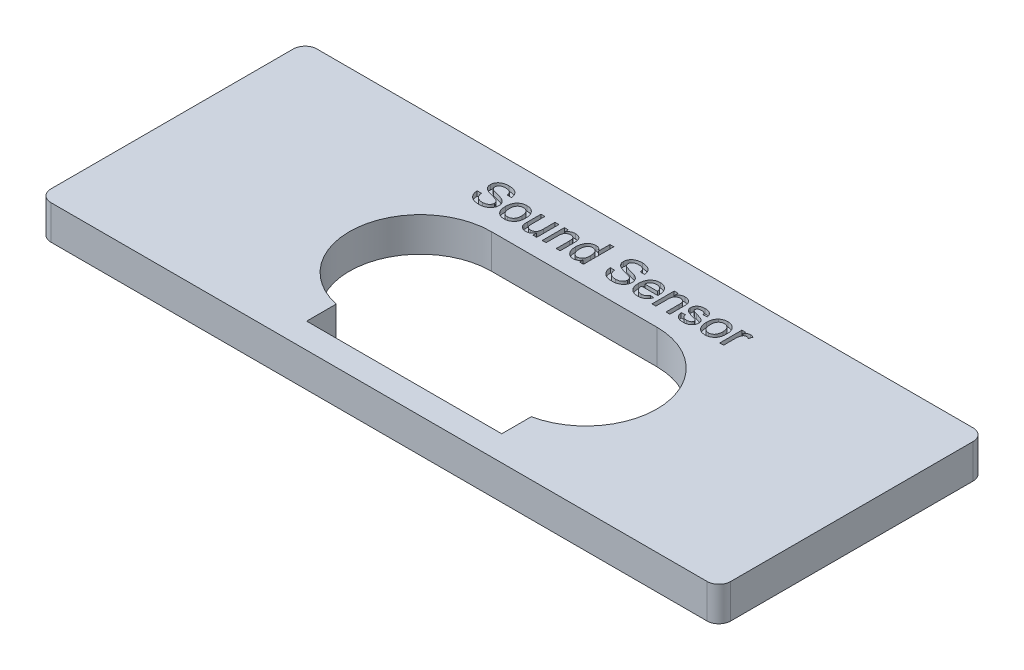
from build123d import *

# Parameters (mm, degrees)
BOSS_EXTRUDE1_DEPTH = 2.9
CUT_EXTRUDE1_DEPTH  = 10
CUT_EXTRUDE2_DEPTH  = 0.5
CUT_EXTRUDE3_DEPTH  = 10


with BuildPart() as part:
    # Sketch1 → Boss-Extrude1 (new body)
    with BuildSketch(Plane(origin=(0, 0, 0), x_dir=(1, 0, 0), z_dir=(0, 1, 0))):
        with BuildLine():
            Line((1, 0), (56.5, 0))
            ThreePointArc((56.5, 0), (57.207106781, 0.292893219), (57.5, 1))
            Line((57.5, 1), (57.5, 21.5))
            ThreePointArc((57.5, 21.5), (57.207106781, 22.207106781), (56.5, 22.5))
            Line((56.5, 22.5), (1, 22.5))
            ThreePointArc((1, 22.5), (0.292893219, 22.207106781), (0, 21.5))
            Line((0, 21.5), (0, 1))
            ThreePointArc((0, 1), (0.292893219, 0.292893219), (1, 0))
        make_face()
    extrude(amount=BOSS_EXTRUDE1_DEPTH)

    # Sketch2 → Cut-Extrude1 (cut)
    with BuildSketch(Plane(origin=(0, 3, 0), x_dir=(1, 0, 0), z_dir=(0, 1, 0))):
        with BuildLine():
            Line((21.75, 16.5), (35.75, 16.5))
            ThreePointArc((35.75, 16.5), (41.75, 10.5), (35.75, 4.5))
            Line((35.75, 4.5), (21.75, 4.5))
            ThreePointArc((21.75, 4.5), (15.75, 10.5), (21.75, 16.5))
        make_face()
    extrude(amount=-CUT_EXTRUDE1_DEPTH, mode=Mode.SUBTRACT)

    # Sketch4 → Cut-Extrude2 (cut)
    # profile 1 of 11: a face of its own
    with BuildSketch(Plane(origin=(0, 3, 0), x_dir=(1, 0, 0), z_dir=(0, 1, 0))):
        with BuildLine():
            Line((18.164635813, 18.889033391), (18.526834602, 18.889033391))
            add(Edge.make_bspline(
                [(18.526834602, 18.889033391), (18.530818579, 18.85651292), (18.538472012, 18.794039345), (18.559871777, 18.705492457), (18.587414654, 18.625879717), (18.62173232, 18.554144523), (18.666875903, 18.491146978), (18.721266154, 18.434324153), (18.787320154, 18.385119028), (18.861880063, 18.341329691), (18.944918993, 18.306948135), (19.033570457, 18.281460522), (19.127411664, 18.266358908), (19.191668348, 18.264411619), (19.22447886, 18.263417301)],
                knots=[0, 0, 0, 0, 1.125557648, 2.162256852, 3.1243583, 4.018160113, 4.88511607, 5.777380551, 6.711250965, 7.707237736, 8.743031335, 9.791730543, 10.872421559, 12, 12, 12, 12], degree=3))
            add(Edge.make_bspline(
                [(19.22447886, 18.263417301), (19.253513338, 18.263954698), (19.310124946, 18.265002519), (19.392019966, 18.27758944), (19.469083417, 18.29544365), (19.539881069, 18.322450937), (19.604151757, 18.355246251), (19.659963648, 18.394912954), (19.707612873, 18.439646097), (19.744925669, 18.490623929), (19.774237857, 18.544040171), (19.795741377, 18.59894656), (19.808550583, 18.655038338), (19.810182809, 18.692779778), (19.810993944, 18.711535405)],
                knots=[0, 0, 0, 0, 1.267006637, 2.470417599, 3.611360613, 4.716023143, 5.771382139, 6.754486395, 7.697536124, 8.612899418, 9.501261124, 10.352596716, 11.181322154, 12, 12, 12, 12], degree=3))
            add(Edge.make_bspline(
                [(19.810993944, 18.711535405), (19.810126826, 18.730101048), (19.808432043, 18.766387571), (19.797387614, 18.819216215), (19.776396116, 18.86756977), (19.749157234, 18.913421801), (19.7112633, 18.95534355), (19.66338859, 18.993970702), (19.604478305, 19.028990452), (19.560510639, 19.048169308), (19.537286905, 19.058299586)],
                knots=[0, 0, 0, 0, 0.942140154, 1.841411588, 2.718743672, 3.605002079, 4.535543111, 5.568170452, 6.715506882, 8, 8, 8, 8], degree=3))
            add(Edge.make_bspline(
                [(19.537286905, 19.058299586), (19.528238595, 19.062012714), (19.507796818, 19.070401345), (19.472760572, 19.081506447), (19.431185629, 19.095866478), (19.382073184, 19.110654973), (19.325686158, 19.126299132), (19.26211843, 19.144005948), (19.19140552, 19.162836178), (19.115552969, 19.182878906), (19.038965006, 19.203259288), (18.965794156, 19.223658755), (18.898473495, 19.244366827), (18.836451576, 19.264305842), (18.780048151, 19.284327118), (18.729103134, 19.303882517), (18.683553009, 19.322575285), (18.655732726, 19.336319791), (18.642594158, 19.342810851)],
                knots=[0, 0, 0, 0, 0.499201778, 1.127787504, 1.87543728, 2.745208432, 3.745951656, 4.863402235, 6.114490242, 7.482339553, 8.869366102, 10.161191451, 11.360587006, 12.46547846, 13.487450326, 14.41601931, 15.251940103, 16, 16, 16, 16], degree=3))
            add(Edge.make_bspline(
                [(18.642594158, 19.342810851), (18.612365978, 19.359140984), (18.554017724, 19.390662392), (18.475487436, 19.447022758), (18.409317696, 19.509565014), (18.355787662, 19.578198474), (18.313838268, 19.65176238), (18.285535196, 19.730381791), (18.266149928, 19.812629618), (18.264338324, 19.869187894), (18.263417301, 19.897942233)],
                knots=[0, 0, 0, 0, 1.158441928, 2.236094408, 3.251151369, 4.220012324, 5.163146324, 6.095083285, 7.031536583, 8, 8, 8, 8], degree=3))
            add(Edge.make_bspline(
                [(18.263417301, 19.897942233), (18.264639682, 19.929782807), (18.267070988, 19.993113477), (18.288638007, 20.086047287), (18.323037815, 20.175474332), (18.362195244, 20.246471774), (18.40038239, 20.300159723), (18.432039824, 20.338824802), (18.467549829, 20.374565469), (18.505818818, 20.407880641), (18.54753089, 20.438272549), (18.591651163, 20.466990263), (18.639776545, 20.491673828), (18.707399864, 20.523090435), (18.797863571, 20.554462854), (18.911746064, 20.581799938), (19.031603647, 20.597898179), (19.113301392, 20.600114174), (19.155023127, 20.601245848)],
                knots=[0, 0, 0, 0, 1.199927478, 2.386647047, 3.578628709, 4.806592355, 5.433127754, 6.062729195, 6.689531802, 7.331674828, 7.974827539, 8.635320743, 9.315455226, 10.01318112, 11.447700238, 12.918145351, 14.426146008, 16, 16, 16, 16], degree=3))
            add(Edge.make_bspline(
                [(19.155023127, 20.601245848), (19.200690336, 20.600199453), (19.289613193, 20.598161922), (19.418820617, 20.581210031), (19.539335772, 20.552099174), (19.633847892, 20.519512491), (19.703719596, 20.486522895), (19.753358401, 20.460781448), (19.799433027, 20.431019647), (19.84235824, 20.398812722), (19.882532757, 20.364175382), (19.918924002, 20.326283719), (19.953112185, 20.286430528), (19.993288063, 20.229213833), (20.036606178, 20.15348786), (20.074060584, 20.055381855), (20.099792198, 19.951839022), (20.104797589, 19.88025721), (20.107338408, 19.843921107)],
                knots=[0, 0, 0, 0, 1.607600973, 3.130308851, 4.577334065, 5.967726088, 6.640410691, 7.296826776, 7.935019992, 8.569057421, 9.185393759, 9.8003086, 10.417295362, 11.032210203, 12.259799365, 13.477607022, 14.719591916, 16, 16, 16, 16], degree=3))
            Line((20.107338408, 19.843921107), (19.745139619, 19.843921107))
            add(Edge.make_bspline(
                [(19.745139619, 19.843921107), (19.742838261, 19.862311871), (19.738335186, 19.898297146), (19.727163655, 19.950391245), (19.711503416, 19.9987739), (19.693160477, 20.043896311), (19.670924995, 20.085289157), (19.645004856, 20.1233499), (19.61508441, 20.157630118), (19.581933539, 20.189035626), (19.54454347, 20.216381057), (19.503106324, 20.240117731), (19.457552154, 20.260169784), (19.407921094, 20.276593071), (19.354203316, 20.289327044), (19.29627664, 20.298694398), (19.234163455, 20.30349184), (19.191387072, 20.30442326), (19.16942876, 20.304901384)],
                knots=[0, 0, 0, 0, 1.074487479, 2.102453544, 3.083708351, 4.020042547, 4.923259678, 5.803182661, 6.684453325, 7.556870173, 8.445961597, 9.363679789, 10.320905216, 11.327237703, 12.390948353, 13.519046902, 14.726457512, 16, 16, 16, 16], degree=3))
            add(Edge.make_bspline(
                [(19.16942876, 20.304901384), (19.146604119, 20.304729343), (19.102421228, 20.304396313), (19.038549849, 20.298325597), (18.979349336, 20.289996359), (18.924921373, 20.277710025), (18.875444259, 20.261627172), (18.830183682, 20.243055168), (18.790406308, 20.219519588), (18.755184858, 20.193304012), (18.724801896, 20.164297927), (18.698616284, 20.133732525), (18.675457132, 20.102505842), (18.65746196, 20.068911005), (18.642811186, 20.034220303), (18.633359826, 19.997781663), (18.626668043, 19.960269106), (18.625971587, 19.934673537), (18.62561609, 19.921608631)],
                knots=[0, 0, 0, 0, 1.464176581, 2.834285765, 4.113735764, 5.29917439, 6.409476712, 7.449999357, 8.431575861, 9.367089851, 10.262376129, 11.120706676, 11.948504824, 12.751342953, 13.560717798, 14.359016663, 15.162382702, 16, 16, 16, 16], degree=3))
            add(Edge.make_bspline(
                [(18.62561609, 19.921608631), (18.626552097, 19.899511946), (18.6283688, 19.856624318), (18.646919995, 19.795693926), (18.675451863, 19.740151926), (18.703560299, 19.709931808), (18.717709248, 19.694719901)],
                knots=[0, 0, 0, 0, 1.050964922, 2.039826012, 3.013306874, 4, 4, 4, 4], degree=3))
            add(Edge.make_bspline(
                [(18.717709248, 19.694719901), (18.726628594, 19.687117719), (18.746353178, 19.67030596), (18.783053806, 19.648057567), (18.828557142, 19.625578401), (18.883167232, 19.60323237), (18.946790116, 19.580748196), (19.019323171, 19.557597974), (19.101042666, 19.534605476), (19.189458201, 19.512448399), (19.278778508, 19.490202249), (19.363662829, 19.468040886), (19.441601004, 19.447038012), (19.512469378, 19.426553149), (19.576341303, 19.406644221), (19.632994799, 19.386894109), (19.682888216, 19.368729016), (19.713453828, 19.355948391), (19.727647064, 19.350013668)],
                knots=[0, 0, 0, 0, 0.523891492, 1.158553688, 1.913783773, 2.794766643, 3.797521443, 4.933638669, 6.202080764, 7.596537849, 9.013317056, 10.322179469, 11.523240428, 12.626146501, 13.623953177, 14.517289671, 15.311498917, 16, 16, 16, 16], degree=3))
            add(Edge.make_bspline(
                [(19.727647064, 19.350013668), (19.746113184, 19.341499601), (19.782359083, 19.324787913), (19.833706252, 19.296255222), (19.881618732, 19.266625558), (19.925709422, 19.23510119), (19.965835754, 19.201615809), (20.002446388, 19.166553082), (20.035762441, 19.130110069), (20.064439611, 19.09112038), (20.090188768, 19.051160155), (20.112720994, 19.009670897), (20.130863511, 18.966408617), (20.146775629, 18.921894801), (20.158221006, 18.875634326), (20.167196491, 18.828094453), (20.17243174, 18.779051733), (20.172936876, 18.745846704), (20.173192733, 18.72902796)],
                knots=[0, 0, 0, 0, 1.198900896, 2.353241543, 3.461831299, 4.520043694, 5.547003373, 6.541368882, 7.508191797, 8.454912692, 9.392021408, 10.310662301, 11.235020644, 12.156274873, 13.095836685, 14.042125239, 15.00831306, 16, 16, 16, 16], degree=3))
            add(Edge.make_bspline(
                [(20.173192733, 18.72902796), (20.171852376, 18.695462319), (20.169191323, 18.628823365), (20.146278689, 18.530594466), (20.110284153, 18.43541121), (20.068071644, 18.359878054), (20.028168064, 18.302181699), (19.994647174, 18.260712197), (19.957474435, 18.222367322), (19.917565001, 18.185945803), (19.874609014, 18.152190759), (19.828244327, 18.121090694), (19.778960298, 18.09232186), (19.708583944, 18.057265351), (19.615112454, 18.020592914), (19.496048541, 17.99005335), (19.370569597, 17.97024158), (19.284408009, 17.968143682), (19.240427955, 17.967072837)],
                knots=[0, 0, 0, 0, 1.197055466, 2.376552968, 3.581957237, 4.820753935, 5.454298064, 6.085440993, 6.72202542, 7.359198513, 8.013298489, 8.67051481, 9.351020706, 10.049282741, 11.476266879, 12.925760103, 14.430794493, 16, 16, 16, 16], degree=3))
            add(Edge.make_bspline(
                [(19.240427955, 17.967072837), (19.212464523, 17.967303604), (19.157688155, 17.967755644), (19.077200401, 17.973229986), (19.000067514, 17.98114889), (18.926365192, 17.992944187), (18.856324556, 18.008418975), (18.789694192, 18.027001205), (18.726316168, 18.048402474), (18.666411929, 18.073569996), (18.61013785, 18.102811906), (18.556482065, 18.134356529), (18.506321615, 18.170113838), (18.459550906, 18.20952196), (18.414984866, 18.251442431), (18.374470626, 18.297587248), (18.336630806, 18.34660697), (18.302330034, 18.398950244), (18.271687515, 18.453932248), (18.244131161, 18.510629617), (18.220914548, 18.569453647), (18.202204166, 18.630107042), (18.186355526, 18.69218391), (18.17536486, 18.756202172), (18.167284152, 18.821960836), (18.165523807, 18.866543814), (18.164635813, 18.889033391)],
                knots=[0, 0, 0, 0, 1.259822038, 2.467811403, 3.633536148, 4.752793854, 5.829021491, 6.863980041, 7.868367876, 8.841470325, 9.788447787, 10.724101269, 11.643985084, 12.560193707, 13.478453146, 14.398077254, 15.323914234, 16.266973849, 17.21495974, 18.158525798, 19.105629373, 20.061269543, 21.017128399, 21.990322895, 22.986232211, 24, 24, 24, 24], degree=3))
        make_face()
    # profile 2 of 11: a face of its own
    with BuildSketch(Plane(origin=(0, 3, 0), x_dir=(1, 0, 0), z_dir=(0, 1, 0))):
        with BuildLine():
            add(Edge.make_bspline(
                [(20.50246436, 18.938424135), (20.503386382, 18.980129887), (20.505170564, 19.060833563), (20.51794689, 19.177940811), (20.539850969, 19.286662486), (20.57059034, 19.3871007), (20.610342439, 19.4792871), (20.659451134, 19.562704462), (20.716562015, 19.638885308), (20.762139753, 19.681946116), (20.784917677, 19.703466179)],
                knots=[0, 0, 0, 0, 1.189940866, 2.302622481, 3.356378305, 4.350088409, 5.294652018, 6.213657312, 7.107257627, 8, 8, 8, 8], degree=3))
            add(Edge.make_bspline(
                [(20.784917677, 19.703466179), (20.804839975, 19.720004545), (20.844321062, 19.752779511), (20.908761532, 19.79434328), (20.975851232, 19.830053689), (21.046182992, 19.859663072), (21.119979088, 19.882285711), (21.197009725, 19.897986832), (21.277176445, 19.90824474), (21.331784841, 19.909258881), (21.359599562, 19.909775432)],
                knots=[0, 0, 0, 0, 0.994414631, 1.970684744, 2.940793954, 3.912782355, 4.898970837, 5.902128985, 6.931451948, 8, 8, 8, 8], degree=3))
            add(Edge.make_bspline(
                [(21.359599562, 19.909775432), (21.390325044, 19.908908561), (21.450445145, 19.907212367), (21.538668162, 19.896151332), (21.622209307, 19.875595999), (21.702144271, 19.848656141), (21.777262651, 19.812754252), (21.848750911, 19.76995184), (21.914858577, 19.718078765), (21.976852648, 19.659446075), (22.032778497, 19.593875419), (22.081503381, 19.521688978), (22.12276639, 19.443510329), (22.156851908, 19.359265355), (22.182991956, 19.268895165), (22.201212236, 19.172592883), (22.212884281, 19.070591771), (22.214069725, 19.000538636), (22.214676816, 18.964662968)],
                knots=[0, 0, 0, 0, 1.026363227, 2.008269884, 2.962742747, 3.895658536, 4.820662428, 5.738204837, 6.673158329, 7.621267452, 8.584296177, 9.545483285, 10.524327568, 11.531652541, 12.575780624, 13.660990097, 14.802144351, 16, 16, 16, 16], degree=3))
            add(Edge.make_bspline(
                [(22.214676816, 18.964662968), (22.214448075, 18.935499868), (22.214003662, 18.87883987), (22.208631724, 18.796281359), (22.20051391, 18.718511622), (22.189465381, 18.645442149), (22.174582477, 18.577190097), (22.156023296, 18.513810268), (22.13450018, 18.454960366), (22.109763262, 18.400577578), (22.081537418, 18.350222594), (22.050787488, 18.302810095), (22.016740483, 18.25841201), (21.979440044, 18.217101919), (21.939389517, 18.178580224), (21.896315636, 18.142700891), (21.850138891, 18.109980462), (21.784946532, 18.070253491), (21.698900731, 18.028623934), (21.589919417, 17.99294828), (21.476222984, 17.971204188), (21.398795742, 17.968461351), (21.359599562, 17.967072837)],
                knots=[0, 0, 0, 0, 1.174068422, 2.28105775, 3.329581501, 4.321819531, 5.255045276, 6.14001734, 6.978936381, 7.776151739, 8.542754425, 9.301196708, 10.049767304, 10.792968067, 11.540167917, 12.285482871, 13.048063169, 13.816653646, 15.357768987, 16.884132754, 18.422646949, 20, 20, 20, 20], degree=3))
            add(Edge.make_bspline(
                [(21.359599562, 17.967072837), (21.328354386, 17.967920249), (21.26719882, 17.969578872), (21.177728038, 17.980895426), (21.092814804, 18.000286431), (21.012715259, 18.028544495), (20.936715508, 18.063232606), (20.865533734, 18.106535338), (20.799032396, 18.157509161), (20.737798797, 18.216482925), (20.681810806, 18.282142586), (20.63401795, 18.355897974), (20.593113107, 18.436227843), (20.559693925, 18.523478637), (20.534166331, 18.61765298), (20.515834377, 18.718502952), (20.504246806, 18.826167197), (20.503069364, 18.9003215), (20.50246436, 18.938424135)],
                knots=[0, 0, 0, 0, 1.022681766, 2.001674804, 2.94671416, 3.868132449, 4.777362857, 5.676573364, 6.589418535, 7.514523194, 8.454681358, 9.407574523, 10.384198733, 11.400667853, 12.460217505, 13.573389442, 14.753137007, 16, 16, 16, 16], degree=3))
        make_face()
        with BuildLine():
            add(Edge.make_bspline(
                [(20.831735986, 18.939453109), (20.832294783, 18.912002289), (20.833375682, 18.858903301), (20.839826554, 18.781832042), (20.85161111, 18.710280682), (20.868006138, 18.643989272), (20.889034694, 18.582948412), (20.914807539, 18.527054756), (20.945043495, 18.476260923), (20.980398655, 18.431394967), (21.018877119, 18.391738443), (21.060379344, 18.357531549), (21.104328161, 18.328485633), (21.150798261, 18.304802434), (21.199579207, 18.286090577), (21.250777133, 18.272617701), (21.304482831, 18.26488154), (21.34105352, 18.263909998), (21.359599562, 18.263417301)],
                knots=[0, 0, 0, 0, 1.36128903, 2.633184439, 3.831299874, 4.953299848, 6.015607462, 7.027679361, 8.000438392, 8.93945591, 9.853536715, 10.73548639, 11.60109037, 12.460616037, 13.316600729, 14.187036799, 15.080594522, 16, 16, 16, 16], degree=3))
            add(Edge.make_bspline(
                [(21.359599562, 18.263417301), (21.377986233, 18.263837478), (21.414264973, 18.26466653), (21.467271541, 18.273443757), (21.518285741, 18.286035569), (21.566886086, 18.304615522), (21.61266821, 18.329124165), (21.656519286, 18.358114637), (21.697550466, 18.392822003), (21.73646915, 18.432402543), (21.771319131, 18.477930507), (21.802578601, 18.528523177), (21.828261997, 18.585324633), (21.849025297, 18.647465064), (21.865601892, 18.715076772), (21.87733157, 18.788185578), (21.883744772, 18.866967089), (21.884840727, 18.921263456), (21.88540519, 18.94922836)],
                knots=[0, 0, 0, 0, 0.904535546, 1.784739026, 2.638791991, 3.488785886, 4.338695884, 5.191202824, 6.07237792, 6.980061329, 7.919174549, 8.889507933, 9.902165842, 10.981000531, 12.111539881, 13.326270405, 14.622917219, 16, 16, 16, 16], degree=3))
            add(Edge.make_bspline(
                [(21.88540519, 18.94922836), (21.884835969, 18.975649345), (21.883728928, 19.027033858), (21.877350262, 19.101724801), (21.865414239, 19.171349796), (21.849338075, 19.23610509), (21.827301638, 19.29545746), (21.801981002, 19.350532107), (21.77072147, 19.400236712), (21.735257891, 19.444851633), (21.696550884, 19.484556011), (21.65541627, 19.519400677), (21.611425556, 19.548016288), (21.565638535, 19.572344319), (21.517313654, 19.590521925), (21.466907593, 19.60427207), (21.414031982, 19.611982569), (21.377973539, 19.612942053), (21.359599562, 19.613430969)],
                knots=[0, 0, 0, 0, 1.329905342, 2.586449315, 3.768451236, 4.882143757, 5.938857988, 6.950440627, 7.927559667, 8.885972819, 9.813736587, 10.714405609, 11.592966897, 12.450023853, 13.318821862, 14.185602452, 15.075453733, 16, 16, 16, 16], degree=3))
            add(Edge.make_bspline(
                [(21.359599562, 19.613430969), (21.341055095, 19.612934181), (21.304487513, 19.611954572), (21.250759211, 19.604277102), (21.199702695, 19.590604951), (21.150673176, 19.572708905), (21.104374654, 19.548798062), (21.060171316, 19.519911608), (21.019239735, 19.485056672), (20.980179187, 19.446013433), (20.945229644, 19.401142409), (20.914787895, 19.35085904), (20.888932168, 19.295314673), (20.868021183, 19.234397049), (20.851606753, 19.168112638), (20.839827546, 19.096559228), (20.833390876, 19.019659521), (20.832298835, 18.966732326), (20.831735986, 18.939453109)],
                knots=[0, 0, 0, 0, 0.920966903, 1.816042154, 2.687956485, 3.542385364, 4.403370762, 5.270444796, 6.159337503, 7.068888003, 8.009500254, 8.976623456, 9.982690403, 11.046802133, 12.170707598, 13.370857791, 14.644913259, 16, 16, 16, 16], degree=3))
        make_face(mode=Mode.SUBTRACT)
    # profile 3 of 11: a face of its own
    with BuildSketch(Plane(origin=(0, 3, 0), x_dir=(1, 0, 0), z_dir=(0, 1, 0))):
        with BuildLine():
            Line((23.76225346, 18), (23.76225346, 18.306634202))
            add(Edge.make_bspline(
                [(23.76225346, 18.306634202), (23.744466558, 18.279646004), (23.71000372, 18.227355283), (23.650357083, 18.157609228), (23.585564392, 18.099004187), (23.516267904, 18.050502464), (23.44170892, 18.013032645), (23.362602212, 17.986298755), (23.278638756, 17.969714558), (23.221090923, 17.967966162), (23.19168747, 17.967072837)],
                knots=[0, 0, 0, 0, 1.113242977, 2.156953118, 3.15292751, 4.11701515, 5.063327705, 6.018459424, 6.987552904, 8, 8, 8, 8], degree=3))
            add(Edge.make_bspline(
                [(23.19168747, 17.967072837), (23.165572771, 17.967876184), (23.113930474, 17.969464817), (23.037894999, 17.981757969), (22.964268685, 18.00110619), (22.894838236, 18.028865787), (22.830712091, 18.061628759), (22.774879625, 18.099885861), (22.727224477, 18.14167043), (22.688216854, 18.188419859), (22.657456791, 18.240527514), (22.631053944, 18.296786389), (22.609696838, 18.358515026), (22.600258026, 18.402037878), (22.595397134, 18.424451706)],
                knots=[0, 0, 0, 0, 1.14139906, 2.257137587, 3.359439405, 4.4637035, 5.520213212, 6.501958096, 7.415523094, 8.283477709, 9.15156189, 10.053979392, 10.997819096, 12, 12, 12, 12], degree=3))
            add(Edge.make_bspline(
                [(22.595397134, 18.424451706), (22.592394178, 18.44225488), (22.585667918, 18.482131846), (22.580954864, 18.549410757), (22.577144856, 18.630028229), (22.576969791, 18.688375935), (22.576875605, 18.719767196)],
                knots=[0, 0, 0, 0, 0.730903206, 1.637135144, 2.728770821, 4, 4, 4, 4], degree=3))
            Line((22.576875605, 18.719767196), (22.576875605, 19.87684827))
            Line((22.576875605, 19.87684827), (22.906147231, 19.87684827))
            Line((22.906147231, 19.87684827), (22.906147231, 18.856106228))
            add(Edge.make_bspline(
                [(22.906147231, 18.856106228), (22.906341564, 18.836556089), (22.906713185, 18.799170598), (22.906887057, 18.745480097), (22.908524979, 18.696941156), (22.910666746, 18.653216125), (22.912786292, 18.614557837), (22.916879684, 18.580853292), (22.919823815, 18.552044152), (22.923510535, 18.534702661), (22.925183247, 18.526834602)],
                knots=[0, 0, 0, 0, 1.42061576, 2.716626151, 3.901017187, 4.948932519, 5.898020561, 6.712672935, 7.41592301, 8, 8, 8, 8], degree=3))
            add(Edge.make_bspline(
                [(22.925183247, 18.526834602), (22.930649635, 18.507190099), (22.941311205, 18.468875722), (22.96900469, 18.416719429), (23.003709895, 18.370604912), (23.046747052, 18.33168152), (23.0972621, 18.301413497), (23.153288564, 18.278984158), (23.215122652, 18.266108044), (23.25799655, 18.264334777), (23.280179219, 18.263417301)],
                knots=[0, 0, 0, 0, 1.016366968, 1.98230867, 2.930175142, 3.88886636, 4.861853572, 5.858076567, 6.891783063, 8, 8, 8, 8], degree=3))
            add(Edge.make_bspline(
                [(23.280179219, 18.263417301), (23.302876821, 18.264354026), (23.348149812, 18.266222431), (23.414918584, 18.279874614), (23.479287214, 18.302970885), (23.540558145, 18.333918337), (23.596540675, 18.372789844), (23.645257697, 18.418564937), (23.683486461, 18.472288448), (23.708936113, 18.521556162), (23.72426578, 18.565067528), (23.734621203, 18.601310601), (23.743215888, 18.641023031), (23.750575662, 18.684256018), (23.755239946, 18.731208227), (23.759729919, 18.781428995), (23.761397013, 18.835174264), (23.761961901, 18.872055593), (23.76225346, 18.891091339)],
                knots=[0, 0, 0, 0, 1.205933618, 2.405374018, 3.604641247, 4.831609779, 6.042767781, 7.216052998, 8.364649776, 9.530476467, 10.150343034, 10.813903158, 11.532636353, 12.30883207, 13.143262752, 14.039474568, 14.988104165, 16, 16, 16, 16], degree=3))
            Line((23.76225346, 18.891091339), (23.76225346, 19.87684827))
            Line((23.76225346, 19.87684827), (24.091525086, 19.87684827))
            Line((24.091525086, 19.87684827), (24.091525086, 18))
            Line((24.091525086, 18), (23.76225346, 18))
        make_face()
    # profile 4 of 11: a face of its own
    with BuildSketch(Plane(origin=(0, 3, 0), x_dir=(1, 0, 0), z_dir=(0, 1, 0))):
        with BuildLine():
            Line((24.552505363, 18), (24.552505363, 19.87684827))
            Line((24.552505363, 19.87684827), (24.881776989, 19.87684827))
            Line((24.881776989, 19.87684827), (24.881776989, 19.614974429))
            add(Edge.make_bspline(
                [(24.881776989, 19.614974429), (24.898753877, 19.638364491), (24.932058613, 19.684250392), (24.990005367, 19.744998452), (25.0540369, 19.795652252), (25.12280371, 19.838105098), (25.197896068, 19.869902825), (25.278160308, 19.89315037), (25.3640421, 19.907265539), (25.423135023, 19.908925868), (25.453371953, 19.909775432)],
                knots=[0, 0, 0, 0, 1.031609736, 2.02378021, 2.987167069, 3.941100767, 4.901503214, 5.890206968, 6.920451719, 8, 8, 8, 8], degree=3))
            add(Edge.make_bspline(
                [(25.453371953, 19.909775432), (25.47982112, 19.909128635), (25.532111475, 19.907849909), (25.608739106, 19.896362111), (25.682172856, 19.877103905), (25.7514198, 19.850782027), (25.814643592, 19.817924418), (25.871316857, 19.781405939), (25.917868845, 19.73798219), (25.956678019, 19.690425472), (25.988105066, 19.638129497), (26.014397943, 19.581726192), (26.0357422, 19.520714099), (26.045292914, 19.477894326), (26.050176775, 19.455997972)],
                knots=[0, 0, 0, 0, 1.157394283, 2.288183909, 3.382623741, 4.475775238, 5.523428825, 6.497939499, 7.417115662, 8.297706763, 9.177144922, 10.080641881, 11.018515479, 12, 12, 12, 12], degree=3))
            add(Edge.make_bspline(
                [(26.050176775, 19.455997972), (26.051660243, 19.447953557), (26.054834295, 19.430741598), (26.057496088, 19.402498105), (26.060744481, 19.370291431), (26.063398942, 19.333756403), (26.064500487, 19.293245854), (26.066500151, 19.24867651), (26.066562375, 19.199952769), (26.066952106, 19.165998043), (26.067154844, 19.148334797)],
                knots=[0, 0, 0, 0, 0.636116052, 1.361043949, 2.205423869, 3.155086239, 4.209902085, 5.358053507, 6.625659551, 8, 8, 8, 8], degree=3))
            Line((26.067154844, 19.148334797), (26.067154844, 18))
            Line((26.067154844, 18), (25.737883217, 18))
            Line((25.737883217, 18), (25.737883217, 19.120552503))
            add(Edge.make_bspline(
                [(25.737883217, 19.120552503), (25.737592533, 19.150407528), (25.737050387, 19.206089296), (25.730529885, 19.283664958), (25.719779587, 19.349430822), (25.703876608, 19.404559223), (25.68216583, 19.451516944), (25.653304561, 19.491997346), (25.617952998, 19.528122888), (25.575497029, 19.558086648), (25.528156358, 19.582864386), (25.476262423, 19.601139163), (25.420155933, 19.611306729), (25.381554902, 19.6127117), (25.361793282, 19.613430969)],
                knots=[0, 0, 0, 0, 1.506563537, 2.809849324, 3.925549524, 4.864928455, 5.69744782, 6.523597672, 7.362170172, 8.236610106, 9.134847232, 10.051947146, 11.002703294, 12, 12, 12, 12], degree=3))
            add(Edge.make_bspline(
                [(25.361793282, 19.613430969), (25.345662138, 19.61298498), (25.313985419, 19.612109191), (25.267184322, 19.606692456), (25.222504503, 19.595820935), (25.178888512, 19.583069389), (25.137690774, 19.564476289), (25.097732638, 19.542973181), (25.059599306, 19.516964125), (25.022861844, 19.487305303), (24.988434135, 19.452083917), (24.959907317, 19.408725236), (24.935819178, 19.358779293), (24.915550643, 19.302098805), (24.900631884, 19.238012211), (24.8893851, 19.167017148), (24.882720512, 19.088952716), (24.882100305, 19.034646466), (24.881776989, 19.006336408)],
                knots=[0, 0, 0, 0, 0.875846439, 1.719899191, 2.550914797, 3.36947983, 4.182361237, 4.99885925, 5.83023976, 6.683685912, 7.559383924, 8.491455913, 9.48648407, 10.564169653, 11.751799509, 13.052676251, 14.463548735, 16, 16, 16, 16], degree=3))
            Line((24.881776989, 19.006336408), (24.881776989, 18))
            Line((24.881776989, 18), (24.552505363, 18))
        make_face()
    # profile 5 of 11: a face of its own
    with BuildSketch(Plane(origin=(0, 3, 0), x_dir=(1, 0, 0), z_dir=(0, 1, 0))):
        with BuildLine():
            Line((27.713512975, 18), (27.713512975, 18.283482291))
            add(Edge.make_bspline(
                [(27.713512975, 18.283482291), (27.699057171, 18.258364756), (27.670942607, 18.209514583), (27.619324142, 18.145140672), (27.563759255, 18.089603153), (27.502071892, 18.044976101), (27.435932331, 18.009517062), (27.364280667, 17.984537441), (27.287580143, 17.970154612), (27.234757617, 17.968114873), (27.207772336, 17.967072837)],
                knots=[0, 0, 0, 0, 1.103362039, 2.145888452, 3.135274512, 4.089918948, 5.037552437, 5.986650811, 6.971446531, 8, 8, 8, 8], degree=3))
            add(Edge.make_bspline(
                [(27.207772336, 17.967072837), (27.189919709, 17.967491333), (27.154469262, 17.968322351), (27.101891236, 17.97428178), (27.050110699, 17.98309796), (26.999839592, 17.997608725), (26.950179469, 18.014079181), (26.902167132, 18.035792428), (26.854702621, 18.060063455), (26.809224937, 18.089284945), (26.764743211, 18.120593699), (26.723858259, 18.156710631), (26.684391276, 18.194408509), (26.648422151, 18.236119892), (26.614325281, 18.280265466), (26.582938875, 18.327764751), (26.554115187, 18.378312051), (26.518862478, 18.450105586), (26.482998376, 18.546451781), (26.451288242, 18.669297345), (26.432741815, 18.800490787), (26.430501108, 18.890689517), (26.429353632, 18.936880674)],
                knots=[0, 0, 0, 0, 0.77053297, 1.530068252, 2.282316003, 3.034891571, 3.786446796, 4.538913108, 5.307166389, 6.0856609, 6.870571251, 7.652718378, 8.438047608, 9.225050126, 10.027638366, 10.844878463, 11.68052307, 12.538083257, 14.29538088, 16.10719674, 18.006478707, 20, 20, 20, 20], degree=3))
            add(Edge.make_bspline(
                [(26.429353632, 18.936880674), (26.430326232, 18.98221924), (26.432231174, 19.071019756), (26.450539748, 19.200820928), (26.478441021, 19.324502934), (26.511724678, 19.42262008), (26.544856371, 19.496403398), (26.572016851, 19.548388192), (26.60183752, 19.597062133), (26.634985227, 19.642068883), (26.671126284, 19.683672854), (26.709619331, 19.722614428), (26.751620557, 19.757454372), (26.795768862, 19.789594238), (26.842501549, 19.817479393), (26.890282962, 19.842416978), (26.939688949, 19.863177599), (26.990485452, 19.879958344), (27.042503345, 19.89357246), (27.09587752, 19.90265898), (27.150533621, 19.908525559), (27.187520621, 19.909355595), (27.206228876, 19.909775432)],
                knots=[0, 0, 0, 0, 1.942572473, 3.804739629, 5.607757427, 7.372400532, 8.234575402, 9.073137612, 9.885175988, 10.679209825, 11.466269922, 12.246051373, 13.023576858, 13.803011661, 14.584731492, 15.35415098, 16.111962335, 16.87916584, 17.645911282, 18.414627976, 19.198108944, 20, 20, 20, 20], degree=3))
            add(Edge.make_bspline(
                [(27.206228876, 19.909775432), (27.233227643, 19.90879744), (27.28610902, 19.906881886), (27.363185356, 19.891479592), (27.435861174, 19.866527263), (27.502772582, 19.830100443), (27.564956397, 19.787367248), (27.62064148, 19.737213304), (27.671620919, 19.682193691), (27.699465165, 19.64059296), (27.713512975, 19.619604812)],
                knots=[0, 0, 0, 0, 1.060352338, 2.076868624, 3.076621313, 4.068618914, 5.061440509, 6.03539041, 7.008827079, 8, 8, 8, 8], degree=3))
            Line((27.713512975, 19.619604812), (27.713512975, 20.568318685))
            Line((27.713512975, 20.568318685), (28.042784601, 20.568318685))
            Line((28.042784601, 20.568318685), (28.042784601, 18))
            Line((28.042784601, 18), (27.713512975, 18))
        make_face()
        with BuildLine():
            add(Edge.make_bspline(
                [(26.758625259, 18.937395161), (26.758954021, 18.910112223), (26.759591942, 18.857173245), (26.766395492, 18.78034274), (26.777397385, 18.708742901), (26.793510459, 18.6425725), (26.813228509, 18.581585759), (26.838055664, 18.526030131), (26.867492915, 18.475892682), (26.900845013, 18.431053055), (26.937774709, 18.391929202), (26.9760495, 18.357534745), (27.015939, 18.328062077), (27.058066924, 18.305057888), (27.101370469, 18.286258674), (27.146551558, 18.272668288), (27.19343988, 18.264926646), (27.225237459, 18.263922053), (27.241213986, 18.263417301)],
                knots=[0, 0, 0, 0, 1.410877411, 2.737623334, 3.985990085, 5.15425658, 6.25668075, 7.296968516, 8.294984083, 9.258336811, 10.180925624, 11.073031181, 11.91760706, 12.739566167, 13.550247201, 14.355718555, 15.173839401, 16, 16, 16, 16], degree=3))
            add(Edge.make_bspline(
                [(27.241213986, 18.263417301), (27.257357159, 18.263951375), (27.289120363, 18.265002217), (27.336016807, 18.272158466), (27.380775996, 18.285254182), (27.423728547, 18.302814456), (27.465001605, 18.325115165), (27.50391026, 18.353104636), (27.541254188, 18.385876512), (27.576753476, 18.423300154), (27.609353752, 18.465940106), (27.637234535, 18.514461365), (27.660735866, 18.568185567), (27.680372549, 18.627038694), (27.695027746, 18.691180478), (27.70567188, 18.760297212), (27.712587917, 18.83470095), (27.713197525, 18.886101719), (27.713512975, 18.912699789)],
                knots=[0, 0, 0, 0, 0.85918428, 1.690525522, 2.516740253, 3.335408561, 4.156363302, 5.007314812, 5.880540866, 6.797374501, 7.748460685, 8.730022766, 9.767976038, 10.864778839, 12.027110887, 13.265104655, 14.584788925, 16, 16, 16, 16], degree=3))
            add(Edge.make_bspline(
                [(27.713512975, 18.912699789), (27.713193334, 18.941869063), (27.71257382, 18.998403648), (27.705700936, 19.079995363), (27.695197245, 19.155691993), (27.679832806, 19.225403999), (27.66002097, 19.289179544), (27.635619169, 19.346850024), (27.607597341, 19.39882452), (27.574323765, 19.444169944), (27.538106427, 19.483800367), (27.50014263, 19.518663601), (27.459454678, 19.547538307), (27.417335379, 19.572086663), (27.372856558, 19.590703814), (27.326302256, 19.603424483), (27.277899617, 19.612181378), (27.244683586, 19.613010474), (27.227837326, 19.613430969)],
                knots=[0, 0, 0, 0, 1.460870622, 2.831394293, 4.098585508, 5.286659173, 6.403387286, 7.438947734, 8.419411421, 9.354210979, 10.24820955, 11.105802691, 11.930715615, 12.742688104, 13.543632756, 14.337822166, 15.156989001, 16, 16, 16, 16], degree=3))
            add(Edge.make_bspline(
                [(27.227837326, 19.613430969), (27.211517836, 19.612936985), (27.179207657, 19.611958971), (27.131846087, 19.604182063), (27.086641547, 19.590928493), (27.043078461, 19.573851155), (27.002390643, 19.550093971), (26.963199591, 19.522118476), (26.926482518, 19.488613238), (26.89159511, 19.450353157), (26.860114108, 19.406468071), (26.832849659, 19.35666241), (26.809692512, 19.301121393), (26.790590149, 19.239659159), (26.776820569, 19.172191097), (26.765675741, 19.099259141), (26.759759127, 19.020325679), (26.759012265, 18.965700568), (26.758625259, 18.937395161)],
                knots=[0, 0, 0, 0, 0.845773811, 1.674507211, 2.479288598, 3.284953443, 4.093262871, 4.914908037, 5.777293998, 6.664794475, 7.594954488, 8.56988236, 9.601878838, 10.709817382, 11.900789722, 13.168188159, 14.532623814, 16, 16, 16, 16], degree=3))
        make_face(mode=Mode.SUBTRACT)
    # profile 6 of 11: a face of its own
    with BuildSketch(Plane(origin=(0, 3, 0), x_dir=(1, 0, 0), z_dir=(0, 1, 0))):
        with BuildLine():
            Line((29.425725432, 18.889033391), (29.78792422, 18.889033391))
            add(Edge.make_bspline(
                [(29.78792422, 18.889033391), (29.791908197, 18.85651292), (29.79956163, 18.794039345), (29.820961395, 18.705492457), (29.848504273, 18.625879717), (29.882821939, 18.554144523), (29.927965521, 18.491146978), (29.982355772, 18.434324153), (30.048409773, 18.385119028), (30.122969681, 18.341329691), (30.206008611, 18.306948135), (30.294660075, 18.281460522), (30.388501283, 18.266358908), (30.452757967, 18.264411619), (30.485568479, 18.263417301)],
                knots=[0, 0, 0, 0, 1.125557648, 2.162256852, 3.1243583, 4.018160113, 4.88511607, 5.777380551, 6.711250965, 7.707237736, 8.743031335, 9.791730543, 10.872421559, 12, 12, 12, 12], degree=3))
            add(Edge.make_bspline(
                [(30.485568479, 18.263417301), (30.514602956, 18.263954698), (30.571214565, 18.265002519), (30.653109584, 18.27758944), (30.730173036, 18.29544365), (30.800970688, 18.322450937), (30.865241375, 18.355246251), (30.921053267, 18.394912954), (30.968702491, 18.439646097), (31.006015288, 18.490623929), (31.035327475, 18.544040171), (31.056830995, 18.59894656), (31.069640201, 18.655038338), (31.071272427, 18.692779778), (31.072083563, 18.711535405)],
                knots=[0, 0, 0, 0, 1.267006637, 2.470417599, 3.611360613, 4.716023143, 5.771382139, 6.754486395, 7.697536124, 8.612899418, 9.501261124, 10.352596716, 11.181322154, 12, 12, 12, 12], degree=3))
            add(Edge.make_bspline(
                [(31.072083563, 18.711535405), (31.071216444, 18.730101048), (31.069521661, 18.766387571), (31.058477232, 18.819216215), (31.037485734, 18.86756977), (31.010246853, 18.913421801), (30.972352918, 18.95534355), (30.924478208, 18.993970702), (30.865567923, 19.028990452), (30.821600258, 19.048169308), (30.798376524, 19.058299586)],
                knots=[0, 0, 0, 0, 0.942140154, 1.841411588, 2.718743672, 3.605002079, 4.535543111, 5.568170452, 6.715506882, 8, 8, 8, 8], degree=3))
            add(Edge.make_bspline(
                [(30.798376524, 19.058299586), (30.789328213, 19.062012714), (30.768886436, 19.070401345), (30.73385019, 19.081506447), (30.692275247, 19.095866478), (30.643162802, 19.110654973), (30.586775776, 19.126299132), (30.523208048, 19.144005948), (30.452495138, 19.162836178), (30.376642587, 19.182878906), (30.300054625, 19.203259288), (30.226883774, 19.223658755), (30.159563113, 19.244366827), (30.097541195, 19.264305842), (30.04113777, 19.284327118), (29.990192753, 19.303882517), (29.944642627, 19.322575285), (29.916822344, 19.336319791), (29.903683777, 19.342810851)],
                knots=[0, 0, 0, 0, 0.499201778, 1.127787504, 1.87543728, 2.745208432, 3.745951656, 4.863402235, 6.114490242, 7.482339553, 8.869366102, 10.161191451, 11.360587006, 12.46547846, 13.487450326, 14.41601931, 15.251940103, 16, 16, 16, 16], degree=3))
            add(Edge.make_bspline(
                [(29.903683777, 19.342810851), (29.873455597, 19.359140984), (29.815107342, 19.390662392), (29.736577054, 19.447022758), (29.670407314, 19.509565014), (29.61687728, 19.578198474), (29.574927887, 19.65176238), (29.546624814, 19.730381791), (29.527239546, 19.812629618), (29.525427942, 19.869187894), (29.524506919, 19.897942233)],
                knots=[0, 0, 0, 0, 1.158441928, 2.236094408, 3.251151369, 4.220012324, 5.163146324, 6.095083285, 7.031536583, 8, 8, 8, 8], degree=3))
            add(Edge.make_bspline(
                [(29.524506919, 19.897942233), (29.5257293, 19.929782807), (29.528160606, 19.993113477), (29.549727625, 20.086047287), (29.584127434, 20.175474332), (29.623284862, 20.246471774), (29.661472008, 20.300159723), (29.693129443, 20.338824802), (29.728639447, 20.374565469), (29.766908436, 20.407880641), (29.808620508, 20.438272549), (29.852740781, 20.466990263), (29.900866164, 20.491673828), (29.968489483, 20.523090435), (30.05895319, 20.554462854), (30.172835682, 20.581799938), (30.292693266, 20.597898179), (30.37439101, 20.600114174), (30.416112745, 20.601245848)],
                knots=[0, 0, 0, 0, 1.199927478, 2.386647047, 3.578628709, 4.806592355, 5.433127754, 6.062729195, 6.689531802, 7.331674828, 7.974827539, 8.635320743, 9.315455226, 10.01318112, 11.447700238, 12.918145351, 14.426146008, 16, 16, 16, 16], degree=3))
            add(Edge.make_bspline(
                [(30.416112745, 20.601245848), (30.461779955, 20.600199453), (30.550702811, 20.598161922), (30.679910236, 20.581210031), (30.800425391, 20.552099174), (30.89493751, 20.519512491), (30.964809215, 20.486522895), (31.014448019, 20.460781448), (31.060522646, 20.431019647), (31.103447859, 20.398812722), (31.143622375, 20.364175382), (31.18001362, 20.326283719), (31.214201803, 20.286430528), (31.254377682, 20.229213833), (31.297695796, 20.15348786), (31.335150203, 20.055381855), (31.360881817, 19.951839022), (31.365887208, 19.88025721), (31.368428027, 19.843921107)],
                knots=[0, 0, 0, 0, 1.607600973, 3.130308851, 4.577334065, 5.967726088, 6.640410691, 7.296826776, 7.935019992, 8.569057421, 9.185393759, 9.8003086, 10.417295362, 11.032210203, 12.259799365, 13.477607022, 14.719591916, 16, 16, 16, 16], degree=3))
            Line((31.368428027, 19.843921107), (31.006229238, 19.843921107))
            add(Edge.make_bspline(
                [(31.006229238, 19.843921107), (31.00392788, 19.862311871), (30.999424805, 19.898297146), (30.988253274, 19.950391245), (30.972593035, 19.9987739), (30.954250095, 20.043896311), (30.932014613, 20.085289157), (30.906094475, 20.1233499), (30.876174028, 20.157630118), (30.843023158, 20.189035626), (30.805633089, 20.216381057), (30.764195943, 20.240117731), (30.718641773, 20.260169784), (30.669010712, 20.276593071), (30.615292935, 20.289327044), (30.557366258, 20.298694398), (30.495253073, 20.30349184), (30.45247669, 20.30442326), (30.430518379, 20.304901384)],
                knots=[0, 0, 0, 0, 1.074487479, 2.102453544, 3.083708351, 4.020042547, 4.923259678, 5.803182661, 6.684453325, 7.556870173, 8.445961597, 9.363679789, 10.320905216, 11.327237703, 12.390948353, 13.519046902, 14.726457512, 16, 16, 16, 16], degree=3))
            add(Edge.make_bspline(
                [(30.430518379, 20.304901384), (30.407693738, 20.304729343), (30.363510847, 20.304396313), (30.299639467, 20.298325597), (30.240438954, 20.289996359), (30.186010992, 20.277710025), (30.136533877, 20.261627172), (30.091273301, 20.243055168), (30.051495927, 20.219519588), (30.016274477, 20.193304012), (29.985891515, 20.164297927), (29.959705902, 20.133732525), (29.93654675, 20.102505842), (29.918551579, 20.068911005), (29.903900804, 20.034220303), (29.894449445, 19.997781663), (29.887757662, 19.960269106), (29.887061205, 19.934673537), (29.886705708, 19.921608631)],
                knots=[0, 0, 0, 0, 1.464176581, 2.834285765, 4.113735764, 5.29917439, 6.409476712, 7.449999357, 8.431575861, 9.367089851, 10.262376129, 11.120706676, 11.948504824, 12.751342953, 13.560717798, 14.359016663, 15.162382702, 16, 16, 16, 16], degree=3))
            add(Edge.make_bspline(
                [(29.886705708, 19.921608631), (29.887641715, 19.899511946), (29.889458418, 19.856624318), (29.908009614, 19.795693926), (29.936541482, 19.740151926), (29.964649918, 19.709931808), (29.978798866, 19.694719901)],
                knots=[0, 0, 0, 0, 1.050964922, 2.039826012, 3.013306874, 4, 4, 4, 4], degree=3))
            add(Edge.make_bspline(
                [(29.978798866, 19.694719901), (29.987718213, 19.687117719), (30.007442796, 19.67030596), (30.044143424, 19.648057567), (30.08964676, 19.625578401), (30.14425685, 19.60323237), (30.207879735, 19.580748196), (30.28041279, 19.557597974), (30.362132284, 19.534605476), (30.45054782, 19.512448399), (30.539868127, 19.490202249), (30.624752447, 19.468040886), (30.702690622, 19.447038012), (30.773558996, 19.426553149), (30.837430921, 19.406644221), (30.894084418, 19.386894109), (30.943977834, 19.368729016), (30.974543447, 19.355948391), (30.988736682, 19.350013668)],
                knots=[0, 0, 0, 0, 0.523891492, 1.158553688, 1.913783773, 2.794766643, 3.797521443, 4.933638669, 6.202080764, 7.596537849, 9.013317056, 10.322179469, 11.523240428, 12.626146501, 13.623953177, 14.517289671, 15.311498917, 16, 16, 16, 16], degree=3))
            add(Edge.make_bspline(
                [(30.988736682, 19.350013668), (31.007202802, 19.341499601), (31.043448701, 19.324787913), (31.094795871, 19.296255222), (31.142708351, 19.266625558), (31.18679904, 19.23510119), (31.226925372, 19.201615809), (31.263536007, 19.166553082), (31.296852059, 19.130110069), (31.325529229, 19.09112038), (31.351278386, 19.051160155), (31.373810613, 19.009670897), (31.391953129, 18.966408617), (31.407865247, 18.921894801), (31.419310625, 18.875634326), (31.428286109, 18.828094453), (31.433521359, 18.779051733), (31.434026495, 18.745846704), (31.434282352, 18.72902796)],
                knots=[0, 0, 0, 0, 1.198900896, 2.353241543, 3.461831299, 4.520043694, 5.547003373, 6.541368882, 7.508191797, 8.454912692, 9.392021408, 10.310662301, 11.235020644, 12.156274873, 13.095836685, 14.042125239, 15.00831306, 16, 16, 16, 16], degree=3))
            add(Edge.make_bspline(
                [(31.434282352, 18.72902796), (31.432941995, 18.695462319), (31.430280941, 18.628823365), (31.407368307, 18.530594466), (31.371373771, 18.43541121), (31.329161262, 18.359878054), (31.289257682, 18.302181699), (31.255736793, 18.260712197), (31.218564054, 18.222367322), (31.17865462, 18.185945803), (31.135698632, 18.152190759), (31.089333945, 18.121090694), (31.040049916, 18.09232186), (30.969673562, 18.057265351), (30.876202073, 18.020592914), (30.757138159, 17.99005335), (30.631659216, 17.97024158), (30.545497628, 17.968143682), (30.501517573, 17.967072837)],
                knots=[0, 0, 0, 0, 1.197055466, 2.376552968, 3.581957237, 4.820753935, 5.454298064, 6.085440993, 6.72202542, 7.359198513, 8.013298489, 8.67051481, 9.351020706, 10.049282741, 11.476266879, 12.925760103, 14.430794493, 16, 16, 16, 16], degree=3))
            add(Edge.make_bspline(
                [(30.501517573, 17.967072837), (30.473554141, 17.967303604), (30.418777774, 17.967755644), (30.338290019, 17.973229986), (30.261157133, 17.98114889), (30.18745481, 17.992944187), (30.117414174, 18.008418975), (30.05078381, 18.027001205), (29.987405787, 18.048402474), (29.927501548, 18.073569996), (29.871227468, 18.102811906), (29.817571684, 18.134356529), (29.767411234, 18.170113838), (29.720640524, 18.20952196), (29.676074485, 18.251442431), (29.635560245, 18.297587248), (29.597720424, 18.34660697), (29.563419652, 18.398950244), (29.532777134, 18.453932248), (29.50522078, 18.510629617), (29.482004166, 18.569453647), (29.463293784, 18.630107042), (29.447445144, 18.69218391), (29.436454478, 18.756202172), (29.42837377, 18.821960836), (29.426613425, 18.866543814), (29.425725432, 18.889033391)],
                knots=[0, 0, 0, 0, 1.259822038, 2.467811403, 3.633536148, 4.752793854, 5.829021491, 6.863980041, 7.868367876, 8.841470325, 9.788447787, 10.724101269, 11.643985084, 12.560193707, 13.478453146, 14.398077254, 15.323914234, 16.266973849, 17.21495974, 18.158525798, 19.105629373, 20.061269543, 21.017128399, 21.990322895, 22.986232211, 24, 24, 24, 24], degree=3))
        make_face()
    # profile 7 of 11: a face of its own
    with BuildSketch(Plane(origin=(0, 3, 0), x_dir=(1, 0, 0), z_dir=(0, 1, 0))):
        with BuildLine():
            Line((33.1428934, 18.559761765), (33.465476696, 18.526834602))
            add(Edge.make_bspline(
                [(33.465476696, 18.526834602), (33.45886246, 18.505075535), (33.445850964, 18.462271194), (33.41945057, 18.401561693), (33.390440102, 18.343884786), (33.356164825, 18.290497319), (33.318556516, 18.240263043), (33.276870025, 18.193582648), (33.230194136, 18.15163395), (33.180263804, 18.112665134), (33.126248247, 18.078418111), (33.068716863, 18.048182071), (33.007458992, 18.023228312), (32.942649466, 18.002440434), (32.874140143, 17.986585616), (32.802058125, 17.975632385), (32.726498516, 17.967872438), (32.674902687, 17.967343698), (32.648471474, 17.967072837)],
                knots=[0, 0, 0, 0, 1.017198368, 2.001028156, 2.958938375, 3.904526299, 4.836491671, 5.766019286, 6.700699831, 7.641977538, 8.598163567, 9.559604839, 10.547559217, 11.555094156, 12.60347703, 13.691418688, 14.817373327, 16, 16, 16, 16], degree=3))
            add(Edge.make_bspline(
                [(32.648471474, 17.967072837), (32.615334554, 17.96785154), (32.550727838, 17.969369768), (32.456377597, 17.981549387), (32.367256026, 18.000816187), (32.283169037, 18.02811386), (32.204655493, 18.063687725), (32.131516014, 18.107439764), (32.063295667, 18.158359157), (32.000976477, 18.217342633), (31.944592566, 18.283080611), (31.8964384, 18.356175482), (31.854675115, 18.434875479), (31.821459243, 18.520458995), (31.795205214, 18.612069139), (31.776989073, 18.710095779), (31.765334389, 18.814149997), (31.764157712, 18.885742227), (31.763553978, 18.92247504)],
                knots=[0, 0, 0, 0, 1.077616366, 2.10101772, 3.089143248, 4.040031729, 4.971276009, 5.886882173, 6.807369977, 7.734796568, 8.672701003, 9.618074947, 10.576315496, 11.565652878, 12.598619221, 13.67195277, 14.805516698, 16, 16, 16, 16], degree=3))
            add(Edge.make_bspline(
                [(31.763553978, 18.92247504), (31.764163563, 18.960576142), (31.765347191, 19.034556868), (31.776852447, 19.142272663), (31.795879763, 19.243407294), (31.821699281, 19.338327686), (31.855911853, 19.426575299), (31.897657391, 19.508117962), (31.946677775, 19.583397171), (32.003446522, 19.651310596), (32.066261526, 19.711702197), (32.133127002, 19.765403647), (32.20544627, 19.80972167), (32.281741077, 19.846517547), (32.362746757, 19.874787837), (32.447964307, 19.895607515), (32.538042592, 19.907355488), (32.599562143, 19.908957379), (32.630978918, 19.909775432)],
                knots=[0, 0, 0, 0, 1.232307979, 2.392766439, 3.499416159, 4.558769794, 5.570548426, 6.555643267, 7.517416609, 8.470735273, 9.412423306, 10.33263532, 11.239503873, 12.150233765, 13.067967044, 14.009932887, 14.983713455, 16, 16, 16, 16], degree=3))
            add(Edge.make_bspline(
                [(32.630978918, 19.909775432), (32.661375843, 19.908993771), (32.72086351, 19.907464036), (32.808014953, 19.895186234), (32.89105974, 19.876000098), (32.96982352, 19.848133284), (33.04390988, 19.811553448), (33.114118957, 19.767894571), (33.179960295, 19.715893088), (33.241011623, 19.65625756), (33.296638471, 19.589657554), (33.344756529, 19.515834784), (33.385500553, 19.435827311), (33.418529683, 19.349023468), (33.443954294, 19.255923578), (33.462373748, 19.156466689), (33.473989928, 19.050686615), (33.475163264, 18.977899427), (33.475766435, 18.940482083)],
                knots=[0, 0, 0, 0, 1.005323219, 1.967446859, 2.906060863, 3.821317632, 4.724696067, 5.63467896, 6.55185077, 7.494776645, 8.453732942, 9.416859909, 10.403972786, 11.418730779, 12.484189468, 13.592581733, 14.76243057, 16, 16, 16, 16], degree=3))
            add(Edge.make_bspline(
                [(33.475766435, 18.940482083), (33.475609747, 18.928820116), (33.475231828, 18.900692404), (33.474595485, 18.872569285), (33.474222974, 18.856106228)],
                knots=[0, 0, 0, 0, 0.829215456, 2, 2, 2, 2], degree=3))
            Line((33.474222974, 18.856106228), (32.092825604, 18.856106228))
            add(Edge.make_bspline(
                [(32.092825604, 18.856106228), (32.094731836, 18.832917018), (32.098461186, 18.787549652), (32.109336517, 18.721866075), (32.124013039, 18.66013698), (32.143769368, 18.602905898), (32.16710817, 18.549531855), (32.195951002, 18.500892777), (32.228084368, 18.455908378), (32.265004807, 18.415675407), (32.304849121, 18.37988851), (32.347487317, 18.348495339), (32.392843779, 18.322457187), (32.440262354, 18.300567481), (32.490186157, 18.284095449), (32.542387354, 18.272307576), (32.597157284, 18.264932716), (32.634556968, 18.263928873), (32.653616343, 18.263417301)],
                knots=[0, 0, 0, 0, 1.224729154, 2.396059788, 3.502114335, 4.561587772, 5.580251543, 6.563724943, 7.533714888, 8.486186356, 9.43260269, 10.350144711, 11.268619442, 12.181885516, 13.095687177, 14.031096784, 14.996620783, 16, 16, 16, 16], degree=3))
            add(Edge.make_bspline(
                [(32.653616343, 18.263417301), (32.681444384, 18.264349029), (32.73535433, 18.266154022), (32.813141497, 18.278817346), (32.884445664, 18.301145327), (32.949767924, 18.332139488), (33.008999879, 18.373224764), (33.060684731, 18.425813159), (33.106636395, 18.488139845), (33.130536496, 18.535351994), (33.1428934, 18.559761765)],
                knots=[0, 0, 0, 0, 1.096312125, 2.123833578, 3.094060441, 4.030938787, 4.962563683, 5.918139224, 6.923629937, 8, 8, 8, 8], degree=3))
        make_face()
        with BuildLine():
            Line((32.092825604, 19.152450692), (33.146494808, 19.152450692))
            add(Edge.make_bspline(
                [(33.146494808, 19.152450692), (33.144422129, 19.168764972), (33.140369586, 19.200662958), (33.131839636, 19.246799409), (33.120463396, 19.289784384), (33.106762458, 19.329456431), (33.090055094, 19.365891497), (33.071178493, 19.39914549), (33.050086263, 19.42957354), (33.033693354, 19.447257058), (33.025590383, 19.455997972)],
                knots=[0, 0, 0, 0, 1.185316253, 2.317552585, 3.379013743, 4.387694847, 5.339152611, 6.263729899, 7.141766409, 8, 8, 8, 8], degree=3))
            add(Edge.make_bspline(
                [(33.025590383, 19.455997972), (33.012643683, 19.468634363), (32.987071739, 19.493593395), (32.944436385, 19.525767184), (32.898615972, 19.55244852), (32.850501303, 19.575469608), (32.799016182, 19.592147782), (32.745191416, 19.604747176), (32.688277751, 19.611884514), (32.649347988, 19.612907641), (32.629435458, 19.613430969)],
                knots=[0, 0, 0, 0, 0.989486767, 1.954405495, 2.91383024, 3.888017634, 4.867526279, 5.869356945, 6.910178459, 8, 8, 8, 8], degree=3))
            add(Edge.make_bspline(
                [(32.629435458, 19.613430969), (32.61141318, 19.613012453), (32.576135815, 19.612193238), (32.524164492, 19.606428426), (32.474353291, 19.596871847), (32.426790511, 19.58269263), (32.381302419, 19.565459472), (32.338208855, 19.543430176), (32.297208173, 19.5178329), (32.258463679, 19.488553096), (32.223414178, 19.455739683), (32.191360953, 19.420786097), (32.164824094, 19.382154368), (32.141295161, 19.341644482), (32.122871848, 19.29799218), (32.108368204, 19.251840515), (32.098043872, 19.203062295), (32.094580526, 19.169471547), (32.092825604, 19.152450692)],
                knots=[0, 0, 0, 0, 1.10270868, 2.158476208, 3.195774995, 4.201977093, 5.192014471, 6.168217026, 7.158254405, 8.146844603, 9.134487423, 10.093158795, 11.042305272, 11.996428104, 12.955501471, 13.934632866, 14.95345241, 16, 16, 16, 16], degree=3))
        make_face(mode=Mode.SUBTRACT)
    # profile 8 of 11: a face of its own
    with BuildSketch(Plane(origin=(0, 3, 0), x_dir=(1, 0, 0), z_dir=(0, 1, 0))):
        with BuildLine():
            Line((33.837965224, 18), (33.837965224, 19.87684827))
            Line((33.837965224, 19.87684827), (34.16723685, 19.87684827))
            Line((34.16723685, 19.87684827), (34.16723685, 19.614974429))
            add(Edge.make_bspline(
                [(34.16723685, 19.614974429), (34.184213738, 19.638364491), (34.217518473, 19.684250392), (34.275465227, 19.744998452), (34.339496761, 19.795652252), (34.408263571, 19.838105098), (34.483355929, 19.869902825), (34.563620169, 19.89315037), (34.649501961, 19.907265539), (34.708594884, 19.908925868), (34.738831814, 19.909775432)],
                knots=[0, 0, 0, 0, 1.031609736, 2.02378021, 2.987167069, 3.941100767, 4.901503214, 5.890206968, 6.920451719, 8, 8, 8, 8], degree=3))
            add(Edge.make_bspline(
                [(34.738831814, 19.909775432), (34.76528098, 19.909128635), (34.817571336, 19.907849909), (34.894198967, 19.896362111), (34.967632717, 19.877103905), (35.036879661, 19.850782027), (35.100103452, 19.817924418), (35.156776717, 19.781405939), (35.203328706, 19.73798219), (35.24213788, 19.690425472), (35.273564927, 19.638129497), (35.299857804, 19.581726192), (35.321202061, 19.520714099), (35.330752775, 19.477894326), (35.335636636, 19.455997972)],
                knots=[0, 0, 0, 0, 1.157394283, 2.288183909, 3.382623741, 4.475775238, 5.523428825, 6.497939499, 7.417115662, 8.297706763, 9.177144922, 10.080641881, 11.018515479, 12, 12, 12, 12], degree=3))
            add(Edge.make_bspline(
                [(35.335636636, 19.455997972), (35.337120104, 19.447953557), (35.340294156, 19.430741598), (35.342955949, 19.402498105), (35.346204342, 19.370291431), (35.348858803, 19.333756403), (35.349960348, 19.293245854), (35.351960012, 19.24867651), (35.352022236, 19.199952769), (35.352411966, 19.165998043), (35.352614704, 19.148334797)],
                knots=[0, 0, 0, 0, 0.636116052, 1.361043949, 2.205423869, 3.155086239, 4.209902085, 5.358053507, 6.625659551, 8, 8, 8, 8], degree=3))
            Line((35.352614704, 19.148334797), (35.352614704, 18))
            Line((35.352614704, 18), (35.023343078, 18))
            Line((35.023343078, 18), (35.023343078, 19.120552503))
            add(Edge.make_bspline(
                [(35.023343078, 19.120552503), (35.023052394, 19.150407528), (35.022510248, 19.206089296), (35.015989745, 19.283664958), (35.005239448, 19.349430822), (34.989336469, 19.404559223), (34.967625691, 19.451516944), (34.938764421, 19.491997346), (34.903412859, 19.528122888), (34.86095689, 19.558086648), (34.813616218, 19.582864386), (34.761722283, 19.601139163), (34.705615794, 19.611306729), (34.667014763, 19.6127117), (34.647253142, 19.613430969)],
                knots=[0, 0, 0, 0, 1.506563537, 2.809849324, 3.925549524, 4.864928455, 5.69744782, 6.523597672, 7.362170172, 8.236610106, 9.134847232, 10.051947146, 11.002703294, 12, 12, 12, 12], degree=3))
            add(Edge.make_bspline(
                [(34.647253142, 19.613430969), (34.631121999, 19.61298498), (34.59944528, 19.612109191), (34.552644182, 19.606692456), (34.507964363, 19.595820935), (34.464348373, 19.583069389), (34.423150635, 19.564476289), (34.383192499, 19.542973181), (34.345059166, 19.516964125), (34.308321704, 19.487305303), (34.273893996, 19.452083917), (34.245367178, 19.408725236), (34.221279039, 19.358779293), (34.201010503, 19.302098805), (34.186091745, 19.238012211), (34.174844961, 19.167017148), (34.168180373, 19.088952716), (34.167560166, 19.034646466), (34.16723685, 19.006336408)],
                knots=[0, 0, 0, 0, 0.875846439, 1.719899191, 2.550914797, 3.36947983, 4.182361237, 4.99885925, 5.83023976, 6.683685912, 7.559383924, 8.491455913, 9.48648407, 10.564169653, 11.751799509, 13.052676251, 14.463548735, 16, 16, 16, 16], degree=3))
            Line((34.16723685, 19.006336408), (34.16723685, 18))
            Line((34.16723685, 18), (33.837965224, 18))
        make_face()
    # profile 9 of 11: a face of its own
    with BuildSketch(Plane(origin=(0, 3, 0), x_dir=(1, 0, 0), z_dir=(0, 1, 0))):
        with BuildLine():
            Line((35.714813493, 18.592688927), (36.04408512, 18.62561609))
            add(Edge.make_bspline(
                [(36.04408512, 18.62561609), (36.04911447, 18.597750621), (36.058746555, 18.544383374), (36.088329573, 18.47083553), (36.128242987, 18.407226089), (36.171235045, 18.362915772), (36.211218149, 18.33436801), (36.24373613, 18.314983312), (36.279482738, 18.2993291), (36.317584441, 18.285786179), (36.358585858, 18.275524045), (36.402468781, 18.268393368), (36.449254897, 18.264394725), (36.481391587, 18.263748507), (36.497862579, 18.263417301)],
                knots=[0, 0, 0, 0, 1.576426584, 3.019132651, 4.39139761, 5.744583744, 6.429748217, 7.128801231, 7.852561526, 8.603024018, 9.382742032, 10.206978913, 11.081024327, 12, 12, 12, 12], degree=3))
            add(Edge.make_bspline(
                [(36.497862579, 18.263417301), (36.514337889, 18.263502687), (36.546316338, 18.26366842), (36.592491837, 18.268130377), (36.635496734, 18.274061923), (36.675133986, 18.282636353), (36.711320973, 18.294179243), (36.744704082, 18.307260317), (36.774419564, 18.323801785), (36.808869049, 18.348068989), (36.844388105, 18.382437973), (36.876818332, 18.428026619), (36.89674041, 18.478141302), (36.899037053, 18.512944103), (36.900191348, 18.53043601)],
                knots=[0, 0, 0, 0, 1.101207713, 2.137435615, 3.099211963, 4.003546554, 4.845050796, 5.637285753, 6.396976949, 7.112904354, 8.451176697, 9.67915534, 10.8335422, 12, 12, 12, 12], degree=3))
            add(Edge.make_bspline(
                [(36.900191348, 18.53043601), (36.900005484, 18.538368007), (36.899640662, 18.553937237), (36.893477826, 18.576245944), (36.884721899, 18.597331228), (36.87208754, 18.617060621), (36.856081219, 18.635511906), (36.836572956, 18.652833899), (36.813524335, 18.668615637), (36.796366522, 18.677584604), (36.787518713, 18.682209651)],
                knots=[0, 0, 0, 0, 0.948511305, 1.861774925, 2.756066261, 3.680846901, 4.658374041, 5.678500434, 6.80286706, 8, 8, 8, 8], degree=3))
            add(Edge.make_bspline(
                [(36.787518713, 18.682209651), (36.780179438, 18.685552932), (36.764142192, 18.692858425), (36.73716253, 18.702792603), (36.705856618, 18.71452383), (36.669346645, 18.725232394), (36.628443336, 18.737835393), (36.582792826, 18.751404232), (36.531970356, 18.764284389), (36.496653979, 18.773587199), (36.478312077, 18.778418704)],
                knots=[0, 0, 0, 0, 0.596822396, 1.30413245, 2.127382897, 3.071041962, 4.119245502, 5.296370109, 6.595843667, 8, 8, 8, 8], degree=3))
            add(Edge.make_bspline(
                [(36.478312077, 18.778418704), (36.453260589, 18.785748682), (36.404986579, 18.799873489), (36.335528092, 18.820971312), (36.271355657, 18.841112664), (36.212427401, 18.860387756), (36.159016164, 18.879550711), (36.110855743, 18.897400479), (36.06827343, 18.915052869), (36.018882663, 18.936127055), (35.964532296, 18.965778638), (35.907037414, 19.00761752), (35.858381479, 19.056448657), (35.818018144, 19.110699834), (35.786334662, 19.169632628), (35.764402551, 19.232358381), (35.750381502, 19.297949154), (35.748629112, 19.342739635), (35.747740656, 19.365448275)],
                knots=[0, 0, 0, 0, 1.22605552, 2.362598816, 3.409724438, 4.385374865, 5.274589806, 6.075051486, 6.797583358, 7.439654886, 8.596878446, 9.697305961, 10.768176168, 11.821850251, 12.863383541, 13.897821176, 14.934201653, 16, 16, 16, 16], degree=3))
            add(Edge.make_bspline(
                [(35.747740656, 19.365448275), (35.748452738, 19.386072112), (35.749862136, 19.42689214), (35.760491032, 19.486805574), (35.777416916, 19.544607361), (35.80185626, 19.599518824), (35.831794942, 19.65133448), (35.867963894, 19.698288013), (35.907746705, 19.741754864), (35.938595768, 19.765947329), (35.954049909, 19.778066782)],
                knots=[0, 0, 0, 0, 1.034021226, 2.046601578, 3.042752055, 4.048071569, 5.054273975, 6.036661087, 7.016446045, 8, 8, 8, 8], degree=3))
            add(Edge.make_bspline(
                [(35.954049909, 19.778066782), (35.966930269, 19.787052998), (35.993917268, 19.805880965), (36.039527215, 19.830517903), (36.091869428, 19.85242281), (36.149826537, 19.872048035), (36.21202081, 19.889317346), (36.277338056, 19.900713932), (36.344711714, 19.908277575), (36.390313516, 19.909270741), (36.413486725, 19.909775432)],
                knots=[0, 0, 0, 0, 0.776203524, 1.626305774, 2.557252601, 3.57906176, 4.650888526, 5.745456612, 6.854321437, 8, 8, 8, 8], degree=3))
            add(Edge.make_bspline(
                [(36.413486725, 19.909775432), (36.44799033, 19.908982871), (36.514980854, 19.907444073), (36.612180227, 19.89563848), (36.702788823, 19.87554113), (36.786325829, 19.848145429), (36.861453446, 19.813892182), (36.927256837, 19.774014348), (36.981900006, 19.72720359), (37.026972484, 19.674464987), (37.063112021, 19.613960657), (37.092036033, 19.545091944), (37.115291287, 19.467245603), (37.125399378, 19.411875276), (37.130681486, 19.38294083)],
                knots=[0, 0, 0, 0, 1.253394935, 2.433530808, 3.550681177, 4.620594829, 5.621516506, 6.544862206, 7.406547904, 8.22431151, 9.054607538, 9.956211395, 10.931993099, 12, 12, 12, 12], degree=3))
            Line((37.130681486, 19.38294083), (36.80140986, 19.350013668))
            add(Edge.make_bspline(
                [(36.80140986, 19.350013668), (36.797492571, 19.369761926), (36.789891575, 19.408080884), (36.766878689, 19.461124737), (36.7342004, 19.506788073), (36.692700249, 19.545548758), (36.642213142, 19.57688082), (36.581866261, 19.598111767), (36.512878379, 19.611724793), (36.463636295, 19.612841862), (36.43766761, 19.613430969)],
                knots=[0, 0, 0, 0, 0.971549383, 1.88516682, 2.771115596, 3.668786025, 4.614654303, 5.622170142, 6.746009326, 8, 8, 8, 8], degree=3))
            add(Edge.make_bspline(
                [(36.43766761, 19.613430969), (36.422057058, 19.613245295), (36.392003539, 19.612887835), (36.348534964, 19.60983572), (36.308573625, 19.604561947), (36.271769161, 19.598377892), (36.238895529, 19.58880815), (36.208999396, 19.578300109), (36.18291365, 19.564845035), (36.153328938, 19.545571765), (36.123891867, 19.517665884), (36.096381815, 19.4814265), (36.079973895, 19.440991007), (36.077999116, 19.412918357), (36.077012282, 19.398889925)],
                knots=[0, 0, 0, 0, 1.202032812, 2.314159929, 3.352655878, 4.305866621, 5.183839704, 5.986040797, 6.742017283, 7.437935182, 8.699432998, 9.843179159, 10.922196019, 12, 12, 12, 12], degree=3))
            add(Edge.make_bspline(
                [(36.077012282, 19.398889925), (36.077343408, 19.389923103), (36.077996401, 19.372240211), (36.085145966, 19.346716916), (36.096000706, 19.322505621), (36.106251676, 19.308016797), (36.111482906, 19.300622924)],
                knots=[0, 0, 0, 0, 1.012137305, 1.99597066, 2.977312565, 4, 4, 4, 4], degree=3))
            add(Edge.make_bspline(
                [(36.111482906, 19.300622924), (36.117754973, 19.293169416), (36.130806473, 19.277659465), (36.156366688, 19.258363232), (36.186108854, 19.240230168), (36.208410014, 19.23055385), (36.220039645, 19.225507834)],
                knots=[0, 0, 0, 0, 0.873299099, 1.81724178, 2.861733162, 4, 4, 4, 4], degree=3))
            add(Edge.make_bspline(
                [(36.220039645, 19.225507834), (36.224489238, 19.223936292), (36.234872113, 19.220269188), (36.253296658, 19.214657876), (36.276574465, 19.20747624), (36.305272089, 19.199264748), (36.338838337, 19.189497444), (36.377820895, 19.178707887), (36.421678288, 19.166368017), (36.452752408, 19.157913962), (36.469051312, 19.153479666)],
                knots=[0, 0, 0, 0, 0.436802817, 1.019254657, 1.782618184, 2.69198815, 3.782349451, 5.018834001, 6.436327698, 8, 8, 8, 8], degree=3))
            add(Edge.make_bspline(
                [(36.469051312, 19.153479666), (36.493246232, 19.146150824), (36.539970978, 19.131997511), (36.607646323, 19.110689624), (36.670652645, 19.090834138), (36.728808103, 19.071840514), (36.782073589, 19.053622676), (36.830705438, 19.036918893), (36.874561248, 19.020817559), (36.926002073, 19.001541846), (36.984443932, 18.975568182), (37.046450543, 18.936183976), (37.100802809, 18.890455301), (37.146924194, 18.838344919), (37.184399048, 18.779417389), (37.210355984, 18.713219517), (37.226962266, 18.640663985), (37.22861092, 18.590040674), (37.229462974, 18.56387766)],
                knots=[0, 0, 0, 0, 1.155996739, 2.232437775, 3.244329082, 4.176768736, 5.029854173, 5.818511279, 6.528027969, 7.165934889, 8.330913826, 9.444808892, 10.513164249, 11.568838208, 12.615385132, 13.688622127, 14.805439433, 16, 16, 16, 16], degree=3))
            add(Edge.make_bspline(
                [(37.229462974, 18.56387766), (37.22839569, 18.5375429), (37.226266578, 18.485008029), (37.20837247, 18.407791038), (37.180460602, 18.332649362), (37.140840641, 18.261142962), (37.090985372, 18.194299694), (37.030107667, 18.135274279), (36.959096715, 18.084371356), (36.87891663, 18.042321812), (36.791400164, 18.007926794), (36.697171493, 17.985152945), (36.597699661, 17.969182553), (36.529314054, 17.967787771), (36.494261171, 17.967072837)],
                knots=[0, 0, 0, 0, 0.894809563, 1.785044015, 2.682170314, 3.614214614, 4.555721535, 5.508634546, 6.486485836, 7.51727745, 8.581064401, 9.676123613, 10.808834633, 12, 12, 12, 12], degree=3))
            add(Edge.make_bspline(
                [(36.494261171, 17.967072837), (36.465434982, 17.96758087), (36.409575112, 17.968565346), (36.328414655, 17.975736959), (36.252530568, 17.987916127), (36.181976532, 18.005338501), (36.116713761, 18.027497066), (36.056556682, 18.054167078), (36.001636257, 18.086196485), (35.951982172, 18.123397921), (35.90727098, 18.165796953), (35.866585429, 18.212524485), (35.830384227, 18.264271936), (35.799126782, 18.320911768), (35.771101119, 18.381845088), (35.747562664, 18.4477708), (35.72847909, 18.518522231), (35.719440643, 18.567576198), (35.714813493, 18.592688927)],
                knots=[0, 0, 0, 0, 1.244406412, 2.411431524, 3.514215425, 4.559320282, 5.545040859, 6.48623969, 7.395443761, 8.283912081, 9.158607275, 10.050831307, 10.954592804, 11.879399228, 12.840196462, 13.8472361, 14.897912238, 16, 16, 16, 16], degree=3))
        make_face()
    # profile 10 of 11: a face of its own
    with BuildSketch(Plane(origin=(0, 3, 0), x_dir=(1, 0, 0), z_dir=(0, 1, 0))):
        with BuildLine():
            add(Edge.make_bspline(
                [(37.492880275, 18.938424135), (37.493802298, 18.980129887), (37.495586479, 19.060833563), (37.508362805, 19.177940811), (37.530266885, 19.286662486), (37.561006255, 19.3871007), (37.600758355, 19.4792871), (37.649867049, 19.562704462), (37.70697793, 19.638885308), (37.752555668, 19.681946116), (37.775333592, 19.703466179)],
                knots=[0, 0, 0, 0, 1.189940866, 2.302622481, 3.356378305, 4.350088409, 5.294652018, 6.213657312, 7.107257627, 8, 8, 8, 8], degree=3))
            add(Edge.make_bspline(
                [(37.775333592, 19.703466179), (37.795255891, 19.720004545), (37.834736978, 19.752779511), (37.899177447, 19.79434328), (37.966267148, 19.830053689), (38.036598907, 19.859663072), (38.110395003, 19.882285711), (38.18742564, 19.897986832), (38.267592361, 19.90824474), (38.322200757, 19.909258881), (38.350015477, 19.909775432)],
                knots=[0, 0, 0, 0, 0.994414631, 1.970684744, 2.940793954, 3.912782355, 4.898970837, 5.902128985, 6.931451948, 8, 8, 8, 8], degree=3))
            add(Edge.make_bspline(
                [(38.350015477, 19.909775432), (38.38074096, 19.908908561), (38.440861061, 19.907212367), (38.529084077, 19.896151332), (38.612625222, 19.875595999), (38.692560187, 19.848656141), (38.767678566, 19.812754252), (38.839166827, 19.76995184), (38.905274493, 19.718078765), (38.967268564, 19.659446075), (39.023194413, 19.593875419), (39.071919296, 19.521688978), (39.113182305, 19.443510329), (39.147267823, 19.359265355), (39.173407872, 19.268895165), (39.191628152, 19.172592883), (39.203300196, 19.070591771), (39.204485641, 19.000538636), (39.205092732, 18.964662968)],
                knots=[0, 0, 0, 0, 1.026363227, 2.008269884, 2.962742747, 3.895658536, 4.820662428, 5.738204837, 6.673158329, 7.621267452, 8.584296177, 9.545483285, 10.524327568, 11.531652541, 12.575780624, 13.660990097, 14.802144351, 16, 16, 16, 16], degree=3))
            add(Edge.make_bspline(
                [(39.205092732, 18.964662968), (39.204863991, 18.935499868), (39.204419577, 18.87883987), (39.19904764, 18.796281359), (39.190929826, 18.718511622), (39.179881296, 18.645442149), (39.164998393, 18.577190097), (39.146439211, 18.513810268), (39.124916095, 18.454960366), (39.100179177, 18.400577578), (39.071953334, 18.350222594), (39.041203404, 18.302810095), (39.007156398, 18.25841201), (38.96985596, 18.217101919), (38.929805433, 18.178580224), (38.886731552, 18.142700891), (38.840554806, 18.109980462), (38.775362447, 18.070253491), (38.689316647, 18.028623934), (38.580335332, 17.99294828), (38.466638899, 17.971204188), (38.389211658, 17.968461351), (38.350015477, 17.967072837)],
                knots=[0, 0, 0, 0, 1.174068422, 2.28105775, 3.329581501, 4.321819531, 5.255045276, 6.14001734, 6.978936381, 7.776151739, 8.542754425, 9.301196708, 10.049767304, 10.792968067, 11.540167917, 12.285482871, 13.048063169, 13.816653646, 15.357768987, 16.884132754, 18.422646949, 20, 20, 20, 20], degree=3))
            add(Edge.make_bspline(
                [(38.350015477, 17.967072837), (38.318770301, 17.967920249), (38.257614736, 17.969578872), (38.168143953, 17.980895426), (38.083230719, 18.000286431), (38.003131175, 18.028544495), (37.927131423, 18.063232606), (37.85594965, 18.106535338), (37.789448311, 18.157509161), (37.728214713, 18.216482925), (37.672226721, 18.282142586), (37.624433866, 18.355897974), (37.583529023, 18.436227843), (37.55010984, 18.523478637), (37.524582246, 18.61765298), (37.506250293, 18.718502952), (37.494662722, 18.826167197), (37.493485279, 18.9003215), (37.492880275, 18.938424135)],
                knots=[0, 0, 0, 0, 1.022681766, 2.001674804, 2.94671416, 3.868132449, 4.777362857, 5.676573364, 6.589418535, 7.514523194, 8.454681358, 9.407574523, 10.384198733, 11.400667853, 12.460217505, 13.573389442, 14.753137007, 16, 16, 16, 16], degree=3))
        make_face()
        with BuildLine():
            add(Edge.make_bspline(
                [(37.822151901, 18.939453109), (37.822710698, 18.912002289), (37.823791597, 18.858903301), (37.83024247, 18.781832042), (37.842027026, 18.710280682), (37.858422053, 18.643989272), (37.87945061, 18.582948412), (37.905223454, 18.527054756), (37.93545941, 18.476260923), (37.970814571, 18.431394967), (38.009293034, 18.391738443), (38.05079526, 18.357531549), (38.094744077, 18.328485633), (38.141214177, 18.304802434), (38.189995123, 18.286090577), (38.241193048, 18.272617701), (38.294898746, 18.26488154), (38.331469435, 18.263909998), (38.350015477, 18.263417301)],
                knots=[0, 0, 0, 0, 1.36128903, 2.633184439, 3.831299874, 4.953299848, 6.015607462, 7.027679361, 8.000438392, 8.93945591, 9.853536715, 10.73548639, 11.60109037, 12.460616037, 13.316600729, 14.187036799, 15.080594522, 16, 16, 16, 16], degree=3))
            add(Edge.make_bspline(
                [(38.350015477, 18.263417301), (38.368402148, 18.263837478), (38.404680888, 18.26466653), (38.457687456, 18.273443757), (38.508701656, 18.286035569), (38.557302002, 18.304615522), (38.603084126, 18.329124165), (38.646935201, 18.358114637), (38.687966381, 18.392822003), (38.726885065, 18.432402543), (38.761735047, 18.477930507), (38.792994516, 18.528523177), (38.818677912, 18.585324633), (38.839441212, 18.647465064), (38.856017808, 18.715076772), (38.867747485, 18.788185578), (38.874160688, 18.866967089), (38.875256643, 18.921263456), (38.875821105, 18.94922836)],
                knots=[0, 0, 0, 0, 0.904535546, 1.784739026, 2.638791991, 3.488785886, 4.338695884, 5.191202824, 6.07237792, 6.980061329, 7.919174549, 8.889507933, 9.902165842, 10.981000531, 12.111539881, 13.326270405, 14.622917219, 16, 16, 16, 16], degree=3))
            add(Edge.make_bspline(
                [(38.875821105, 18.94922836), (38.875251885, 18.975649345), (38.874144844, 19.027033858), (38.867766178, 19.101724801), (38.855830154, 19.171349796), (38.83975399, 19.23610509), (38.817717554, 19.29545746), (38.792396918, 19.350532107), (38.761137385, 19.400236712), (38.725673807, 19.444851633), (38.686966799, 19.484556011), (38.645832185, 19.519400677), (38.601841472, 19.548016288), (38.556054451, 19.572344319), (38.507729569, 19.590521925), (38.457323508, 19.60427207), (38.404447897, 19.611982569), (38.368389454, 19.612942053), (38.350015477, 19.613430969)],
                knots=[0, 0, 0, 0, 1.329905342, 2.586449315, 3.768451236, 4.882143757, 5.938857988, 6.950440627, 7.927559667, 8.885972819, 9.813736587, 10.714405609, 11.592966897, 12.450023853, 13.318821862, 14.185602452, 15.075453733, 16, 16, 16, 16], degree=3))
            add(Edge.make_bspline(
                [(38.350015477, 19.613430969), (38.331471011, 19.612934181), (38.294903428, 19.611954572), (38.241175126, 19.604277102), (38.19011861, 19.590604951), (38.141089092, 19.572708905), (38.09479057, 19.548798062), (38.050587231, 19.519911608), (38.009655651, 19.485056672), (37.970595102, 19.446013433), (37.935645559, 19.401142409), (37.90520381, 19.35085904), (37.879348084, 19.295314673), (37.858437098, 19.234397049), (37.842022669, 19.168112638), (37.830243462, 19.096559228), (37.823806791, 19.019659521), (37.82271475, 18.966732326), (37.822151901, 18.939453109)],
                knots=[0, 0, 0, 0, 0.920966903, 1.816042154, 2.687956485, 3.542385364, 4.403370762, 5.270444796, 6.159337503, 7.068888003, 8.009500254, 8.976623456, 9.982690403, 11.046802133, 12.170707598, 13.370857791, 14.644913259, 16, 16, 16, 16], degree=3))
        make_face(mode=Mode.SUBTRACT)
    # profile 11 of 11: a face of its own
    with BuildSketch(Plane(origin=(0, 3, 0), x_dir=(1, 0, 0), z_dir=(0, 1, 0))):
        with BuildLine():
            Line((39.567291521, 18), (39.567291521, 19.87684827))
            Line((39.567291521, 19.87684827), (39.863635984, 19.87684827))
            Line((39.863635984, 19.87684827), (39.863635984, 19.614974429))
            add(Edge.make_bspline(
                [(39.863635984, 19.614974429), (39.880212439, 19.642672834), (39.910922546, 19.693987845), (39.959358078, 19.761607858), (40.005443949, 19.814568389), (40.051966901, 19.852304848), (40.098523653, 19.878421524), (40.146063524, 19.896401443), (40.195801433, 19.907822942), (40.229717394, 19.909118152), (40.246928737, 19.909775432)],
                knots=[0, 0, 0, 0, 1.517336028, 2.811068648, 3.907416798, 4.807929446, 5.613162482, 6.406966847, 7.191583018, 8, 8, 8, 8], degree=3))
            add(Edge.make_bspline(
                [(40.246928737, 19.909775432), (40.272402172, 19.908638594), (40.324033782, 19.906334359), (40.401395217, 19.888650344), (40.479671958, 19.861838927), (40.529528261, 19.835375098), (40.555106399, 19.82179817)],
                knots=[0, 0, 0, 0, 0.943117096, 1.911585642, 2.928565726, 4, 4, 4, 4], degree=3))
            Line((40.555106399, 19.82179817), (40.452209016, 19.536257931))
            add(Edge.make_bspline(
                [(40.452209016, 19.536257931), (40.434344897, 19.54813548), (40.399892125, 19.571042541), (40.344648719, 19.595303569), (40.289449788, 19.610788124), (40.252341288, 19.612558913), (40.234066564, 19.613430969)],
                knots=[0, 0, 0, 0, 1.093324321, 2.108587182, 3.068540977, 4, 4, 4, 4], degree=3))
            add(Edge.make_bspline(
                [(40.234066564, 19.613430969), (40.218214488, 19.612625658), (40.186915154, 19.611035601), (40.141182931, 19.598685306), (40.098156889, 19.578273582), (40.057870195, 19.550428692), (40.022039432, 19.515232552), (39.990591353, 19.474070196), (39.965178256, 19.426218601), (39.953508422, 19.391202296), (39.947497352, 19.373165579)],
                knots=[0, 0, 0, 0, 0.946345552, 1.868524143, 2.808299705, 3.780481321, 4.780563855, 5.797153696, 6.865325266, 8, 8, 8, 8], degree=3))
            add(Edge.make_bspline(
                [(39.947497352, 19.373165579), (39.939647121, 19.343946212), (39.923708871, 19.284622405), (39.908405555, 19.19231258), (39.898058671, 19.096094614), (39.897068672, 19.030546585), (39.896563147, 18.997075643)],
                knots=[0, 0, 0, 0, 0.953038166, 1.934944501, 2.945515915, 4, 4, 4, 4], degree=3))
            Line((39.896563147, 18.997075643), (39.896563147, 18))
            Line((39.896563147, 18), (39.567291521, 18))
        make_face()
    extrude(amount=-CUT_EXTRUDE2_DEPTH, mode=Mode.SUBTRACT)

    # Sketch5 → Cut-Extrude3 (cut)
    with BuildSketch(Plane(origin=(0, 3, 0), x_dir=(1, 0, 0), z_dir=(0, 1, 0))):
        Polygon((28.75, 2.131652703), (37, 2.131652703), (37, 4.631652703), (20.5, 4.631652703), (20.5, 2.131652703), align=None)
    extrude(amount=-CUT_EXTRUDE3_DEPTH, mode=Mode.SUBTRACT)


solid = part.part
